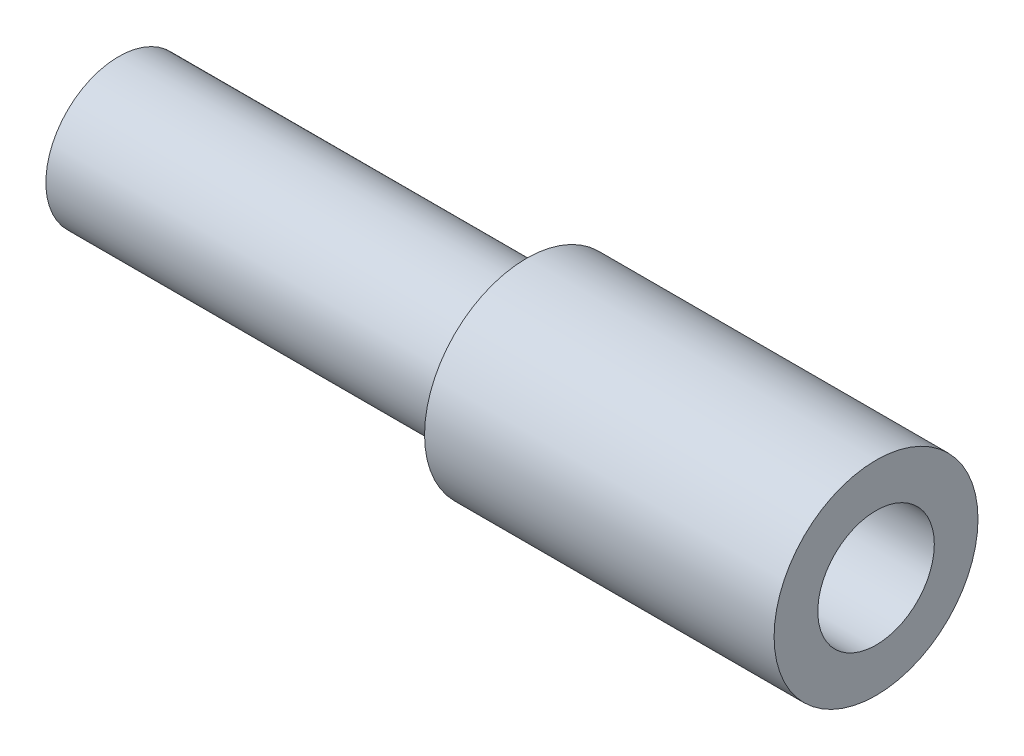
from build123d import *

# Parameters (mm, degrees)
SZKIC1_R                    = 12.5
SZKIC1_R_2                  = 10
DODANIE_WYCI_GNI_CIE1_DEPTH = 70
SZKIC2_R                    = 17.5
SZKIC2_R_2                  = 10
DODANIE_WYCI_GNI_CIE2_DEPTH = 60
ZAOKR_GLENIE1_R             = 0.3


with BuildPart() as part:
    # Szkic1 → Dodanie-wyciągnięcie1 (new body)
    with BuildSketch(Plane(origin=(0, 0, 0), x_dir=(0, 0, -1), z_dir=(1, 0, 0))):
        Circle(SZKIC1_R)
        Circle(SZKIC1_R_2, mode=Mode.SUBTRACT)
    extrude(amount=DODANIE_WYCI_GNI_CIE1_DEPTH)

    # Szkic2 → Dodanie-wyciągnięcie2 (add)
    with BuildSketch(Plane(origin=(70, 0, 0), x_dir=(0, 0, -1), z_dir=(1, 0, 0))):
        Circle(SZKIC2_R)
        Circle(SZKIC2_R_2, mode=Mode.SUBTRACT)
    extrude(amount=DODANIE_WYCI_GNI_CIE2_DEPTH)

    # Zaokrąglenie1
    zaokr_glenie1_edges = [part.edges().sort_by_distance(p)[0] for p in [
        (70, 0, 12.5),
    ]]
    fillet(zaokr_glenie1_edges, radius=ZAOKR_GLENIE1_R)


solid = part.part
